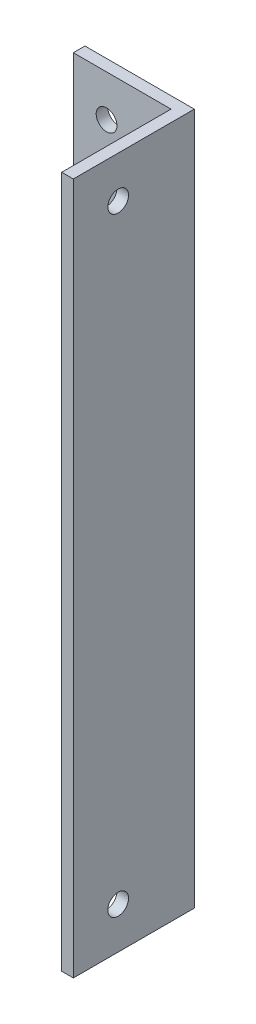
from build123d import *

# Parameters (mm, degrees)
ESBO_O1_W                = 15.8
ESBO_O1_H                = 100
RESSALTO_EXTRUS_O1_DEPTH = 1.68
ESBO_O3_W                = 1.68
ESBO_O3_H                = 100
RESSALTO_EXTRUS_O2_DEPTH = 15.8
ESBO_O4_R                = 1.5
CORTE_EXTRUS_O1_DEPTH    = 103.493535406
ESBO_O5_R                = 1.5
CORTE_EXTRUS_O2_DEPTH    = 103.465994359


with BuildPart() as part:
    # Esboço1 → Ressalto-extrusão1 (new body)
    with BuildSketch(Plane.XY):
        with Locations((-7.9, 50)):
            Rectangle(ESBO_O1_W, ESBO_O1_H)
    extrude(amount=RESSALTO_EXTRUS_O1_DEPTH)

    # Esboço3 → Ressalto-extrusão2 (add)
    with BuildSketch(Plane.XY.offset(1.68)):
        with Locations((-0.84, 50)):
            Rectangle(ESBO_O3_W, ESBO_O3_H)
    extrude(amount=RESSALTO_EXTRUS_O2_DEPTH)

    # Esboço4 → Corte-extrusão1 (cut, through all)
    with BuildSketch(Plane.ZY.offset(1.68)):
        with Locations((11, 94)):
            Circle(ESBO_O4_R)
        with Locations((11, 6)):
            Circle(ESBO_O4_R)
    extrude(amount=-CORTE_EXTRUS_O1_DEPTH, mode=Mode.SUBTRACT)

    # Esboço5 → Corte-extrusão2 (cut, through all)
    with BuildSketch(Plane.XY.offset(1.68)):
        with Locations((-11, 94)):
            Circle(ESBO_O5_R)
        with Locations((-11, 6)):
            Circle(ESBO_O5_R)
    extrude(amount=-CORTE_EXTRUS_O2_DEPTH, mode=Mode.SUBTRACT)


solid = part.part
